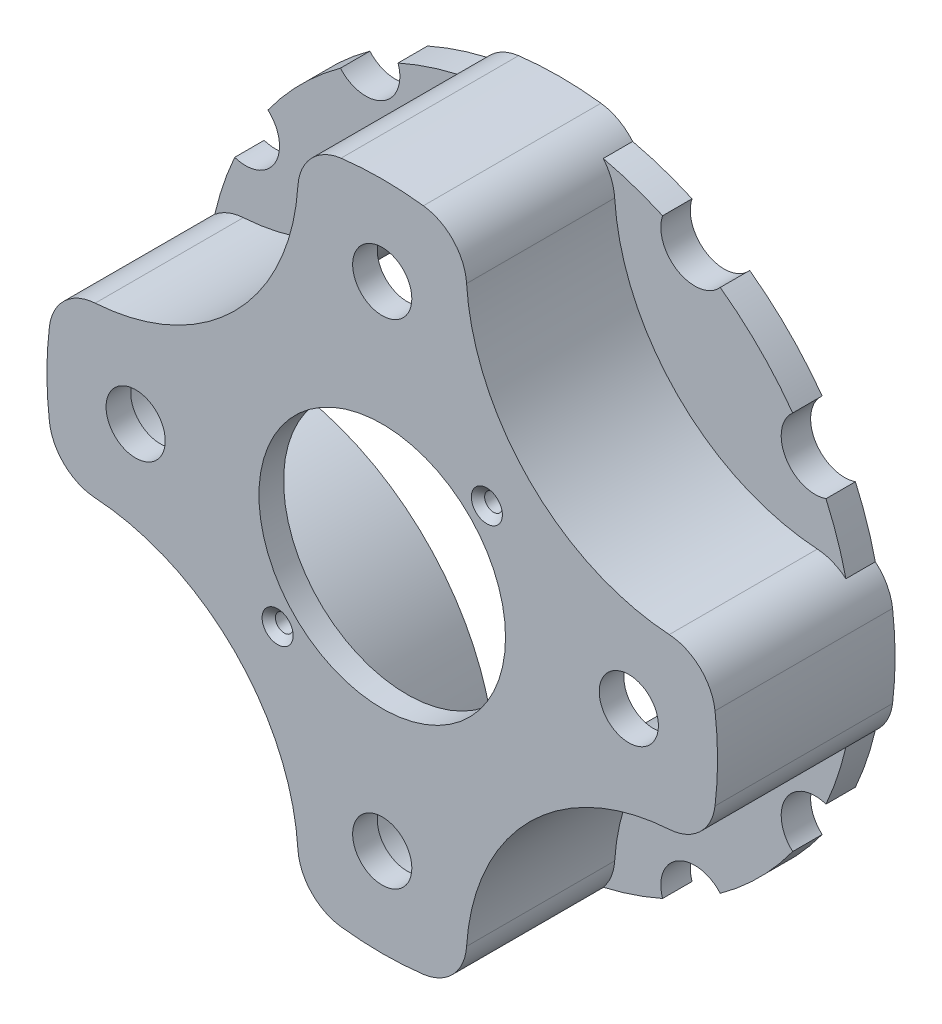
from build123d import *

# Parameters (mm, degrees)
SKETCH6_R                                       = 68
SKETCH6_R_2                                     = 64
SKETCH6_R_3                                     = 62
BOSS_EXTRUDE1_DEPTH                             = 36
SKETCH7_R                                       = 44
CUT_EXTRUDE2_DEPTH                              = 30.031
CIRPATTERN1_COUNT                               = 4
CUT_EXTRUDE3_DEPTH                              = 31
FILLET4_R                                       = 10
CUT_EXTRUDE5_DEPTH                              = 101.746518522
CIRPATTERN3_COUNT                               = 4
SKETCH11_R                                      = 6
SKETCH11_R_2                                    = 25
CUT_EXTRUDE6_DEPTH                              = 103.683981391
SKETCH12_R                                      = 1.5
CUT_EXTRUDE7_DEPTH                              = 103.683981391
CSK_FOR_M3_FLAT_HEAD_MACHINE_SCREW1_D           = 3.6
CSK_FOR_M3_FLAT_HEAD_MACHINE_SCREW1_DEPTH       = 10
CSK_FOR_M3_FLAT_HEAD_MACHINE_SCREW1_CSINK_D     = 6.3
CSK_FOR_M3_FLAT_HEAD_MACHINE_SCREW1_CSINK_ANGLE = 90
CSK_FOR_M3_FLAT_HEAD_MACHINE_SCREW1_TIP         = 1.081549114


with BuildPart() as part:
    # Sketch6 → Boss-Extrude1 (new body)
    # profile 1 of 3: a face of its own
    with BuildSketch(Plane.XY):
        Circle(SKETCH6_R)
        Circle(SKETCH6_R_2, mode=Mode.SUBTRACT)
    # profile 2 of 3: a face of its own
    with BuildSketch(Plane.XY):
        Circle(SKETCH6_R_2)
    # profile 3 of 3: a face of its own
    with BuildSketch(Plane.XY):
        Circle(SKETCH6_R_3)
    extrude(amount=-BOSS_EXTRUDE1_DEPTH)

    # Sketch7 → Cut-Extrude2 (cut)
    with BuildSketch(Plane.XY):
        with Locations((-61.013886211, 61.013886211)):
            Circle(SKETCH7_R)
    cut_extrude2 = extrude(amount=-CUT_EXTRUDE2_DEPTH, mode=Mode.SUBTRACT)

    # CirPattern1: Cut-Extrude2 ×4 about axis
    cirpattern1_axis = Axis((0, 0, 0), (0, 0, 1))
    for i in range(1, CIRPATTERN1_COUNT):
        add(cut_extrude2.rotate(cirpattern1_axis, i * 360 / CIRPATTERN1_COUNT), mode=Mode.SUBTRACT)

    # Sketch9 → Cut-Extrude3 (cut)
    with BuildSketch(Plane(origin=(0, 0, -36), x_dir=(-1, 0, 0), z_dir=(0, 0, -1))):
        with BuildLine():
            ThreePointArc((62.657048552, -13.042019273), (27.072760714, -27.072760714), (13.042019273, -62.657048552))
            ThreePointArc((13.042019273, -62.657048552), (0, -64), (-13.042019273, -62.657048552))
            ThreePointArc((-13.042019273, -62.657048552), (-27.072760714, -27.072760714), (-62.657048552, -13.042019273))
            ThreePointArc((-62.657048552, -13.042019273), (-64, 0), (-62.657048552, 13.042019273))
            ThreePointArc((-62.657048552, 13.042019273), (-27.072760714, 27.072760714), (-13.042019273, 62.657048552))
            ThreePointArc((-13.042019273, 62.657048552), (0, 64), (13.042019273, 62.657048552))
            ThreePointArc((13.042019273, 62.657048552), (27.072760714, 27.072760714), (62.657048552, 13.042019273))
            ThreePointArc((62.657048552, 13.042019273), (64, 0), (62.657048552, -13.042019273))
        make_face()
    extrude(amount=-CUT_EXTRUDE3_DEPTH, mode=Mode.SUBTRACT)

    # Fillet4
    fillet4_edges = [part.edges().sort_by_distance(p)[0] for p in [
        (-17.271690509, -65.769968124, -15.0155),
        (-65.769968124, -17.271690509, -15.0155),
        (65.769968124, -17.271690509, -15.0155),
        (17.271690509, -65.769968124, -15.0155),
        (17.271690509, 65.769968124, -15.0155),
        (65.769968124, 17.271690509, -15.0155),
        (-62.657048552, 13.042019273, -20.5),
        (-13.042019273, 62.657048552, -20.5),
        (13.042019273, 62.657048552, -20.5),
        (62.657048552, 13.042019273, -20.5),
        (62.657048552, -13.042019273, -20.5),
        (13.042019273, -62.657048552, -20.5),
        (-13.042019273, -62.657048552, -20.5),
        (-62.657048552, -13.042019273, -20.5),
        (-65.769968124, 17.271690509, -15.0155),
        (-17.271690509, 65.769968124, -15.0155),
    ]]
    fillet(fillet4_edges, radius=FILLET4_R)

    # Sketch10 → Cut-Extrude5 (cut, through all)
    with BuildSketch(Plane.XY.offset(-30.031)):
        with BuildLine():
            ThreePointArc((-26.820904169, 59.948684093), (-20.900481427, 62.2605453), (-14.784311445, 63.989294105))
            add(Edge.make_bspline(
                [(-8.352752445, 67.485046689), (-8.883437553, 67.419362785), (-9.42082196, 67.31827467), (-9.960949869, 67.179607293), (-10.499190606, 67.001856884), (-11.030427413, 66.78455211), (-12.072716893, 66.270230908), (-12.583596153, 65.972585782), (-13.076868993, 65.636201374), (-13.547283942, 65.262993018), (-13.990103226, 64.856113871), (-14.467362967, 64.349752368), (-14.532423803, 64.279110922), (-14.596663842, 64.207726881), (-14.660067975, 64.135617483), (-14.722621759, 64.062800483), (-14.784311445, 63.989294105)],
                knots=[0, 0, 0, 0, 0, 0, 0, 0.249012775, 0.249012775, 0.249012775, 0.249012775, 0.249012775, 0.5, 0.5, 0.5, 0.5, 0.5, 0.540184109, 0.540184109, 0.540184109, 0.540184109, 0.540184109, 0.540184109, 0.540184109], degree=6))
            ThreePointArc((-8.352752445, 67.485046689), (-18.348613627, 65.477693743), (-27.932001203, 61.99841376))
            ThreePointArc((-27.932001203, 61.99841376), (-27.288993324, 61.020958026), (-26.820904169, 59.948684093))
        make_face()
        with BuildLine():
            ThreePointArc((-26.4575, 57.742243797), (-26.548958945, 58.860327132), (-26.820904169, 59.948684093))
            ThreePointArc((-26.820904169, 59.948684093), (-32.8375, 56.876218394), (-38.506631264, 53.20192641))
            ThreePointArc((-38.506631264, 53.20192641), (-30.911518044, 51.304153122), (-26.4575, 57.742243797))
        make_face()
        with BuildLine():
            ThreePointArc((-38.506631264, 53.20192641), (-32.8375, 56.876218394), (-26.820904169, 59.948684093))
            ThreePointArc((-26.820904169, 59.948684093), (-27.288993324, 61.020958026), (-27.932001203, 61.99841376))
            ThreePointArc((-27.932001203, 61.99841376), (-34, 58.889727457), (-39.726200709, 55.1890295))
            ThreePointArc((-39.726200709, 55.1890295), (-39.201203152, 54.143440476), (-38.506631264, 53.20192641))
        make_face()
        with BuildLine():
            ThreePointArc((-53.20192641, 38.506631264), (-46.439237854, 46.439237854), (-38.506631264, 53.20192641))
            ThreePointArc((-38.506631264, 53.20192641), (-39.201203152, 54.143440476), (-39.726200709, 55.1890295))
            ThreePointArc((-39.726200709, 55.1890295), (-48.083261121, 48.083261121), (-55.1890295, 39.726200709))
            ThreePointArc((-55.1890295, 39.726200709), (-54.143440476, 39.201203152), (-53.20192641, 38.506631264))
        make_face()
        with BuildLine():
            add(Edge.make_bspline(
                [(-67.485046689, 8.352752445), (-67.419362785, 8.883437553), (-67.31827467, 9.42082196), (-67.179607293, 9.960949869), (-67.001856884, 10.499190606), (-66.78455211, 11.030427413), (-66.270230908, 12.072716893), (-65.972585782, 12.583596153), (-65.636201374, 13.076868993), (-65.262993018, 13.547283942), (-64.856113871, 13.990103226), (-64.349752368, 14.467362967), (-64.279110922, 14.532423803), (-64.207726881, 14.596663842), (-64.135617483, 14.660067975), (-64.062800483, 14.722621759), (-63.989294105, 14.784311445)],
                knots=[0, 0, 0, 0, 0, 0, 0, 0.249012775, 0.249012775, 0.249012775, 0.249012775, 0.249012775, 0.5, 0.5, 0.5, 0.5, 0.5, 0.540184109, 0.540184109, 0.540184109, 0.540184109, 0.540184109, 0.540184109, 0.540184109], degree=6))
            ThreePointArc((-63.989294105, 14.784311445), (-62.2605453, 20.900481427), (-59.948684093, 26.820904169))
            ThreePointArc((-59.948684093, 26.820904169), (-61.020958026, 27.288993324), (-61.99841376, 27.932001203))
            ThreePointArc((-61.99841376, 27.932001203), (-65.477693743, 18.348613627), (-67.485046689, 8.352752445))
        make_face()
        with BuildLine():
            ThreePointArc((-50.862243797, 33.3375), (-51.47439793, 36.174489282), (-53.20192641, 38.506631264))
            ThreePointArc((-53.20192641, 38.506631264), (-56.876218394, 32.8375), (-59.948684093, 26.820904169))
            ThreePointArc((-59.948684093, 26.820904169), (-53.732624691, 27.746672278), (-50.862243797, 33.3375))
        make_face()
        with BuildLine():
            ThreePointArc((-59.948684093, 26.820904169), (-56.876218394, 32.8375), (-53.20192641, 38.506631264))
            ThreePointArc((-53.20192641, 38.506631264), (-54.143440476, 39.201203152), (-55.1890295, 39.726200709))
            ThreePointArc((-55.1890295, 39.726200709), (-58.889727457, 34), (-61.99841376, 27.932001203))
            ThreePointArc((-61.99841376, 27.932001203), (-61.020958026, 27.288993324), (-59.948684093, 26.820904169))
        make_face()
    cut_extrude5 = extrude(amount=-CUT_EXTRUDE5_DEPTH, mode=Mode.SUBTRACT)

    # CirPattern3: Cut-Extrude5 ×4 about axis
    cirpattern3_axis = Axis((0, 0, 0), (0, 0, 1))
    for i in range(1, CIRPATTERN3_COUNT):
        add(cut_extrude5.rotate(cirpattern3_axis, i * 360 / CIRPATTERN3_COUNT), mode=Mode.SUBTRACT)

    # Sketch11 → Cut-Extrude6 (cut, through all)
    with BuildSketch(Plane.XY):
        with Locations((0, -50)):
            Circle(SKETCH11_R)
        with Locations((50, 0)):
            Circle(SKETCH11_R)
        with Locations((0, 50)):
            Circle(SKETCH11_R)
        Circle(SKETCH11_R_2)
        with Locations((-50, 0)):
            Circle(SKETCH11_R)
    extrude(amount=-CUT_EXTRUDE6_DEPTH, mode=Mode.SUBTRACT)

    # Sketch12 → Cut-Extrude7 (cut, through all)
    with BuildSketch(Plane.XY):
        with Locations((21.213203436, 21.213203436)):
            Circle(SKETCH12_R)
        with Locations((-21.213203436, -21.213203436)):
            Circle(SKETCH12_R)
    extrude(amount=-CUT_EXTRUDE7_DEPTH, mode=Mode.SUBTRACT)

    # CSK for M3 Flat Head Machine Screw1
    with Locations(Plane.XY):
        with Locations((21.213203436, 21.213203436), (-21.213203436, -21.213203436)):
            CounterSinkHole(CSK_FOR_M3_FLAT_HEAD_MACHINE_SCREW1_D / 2, CSK_FOR_M3_FLAT_HEAD_MACHINE_SCREW1_CSINK_D / 2, depth=CSK_FOR_M3_FLAT_HEAD_MACHINE_SCREW1_DEPTH, counter_sink_angle=CSK_FOR_M3_FLAT_HEAD_MACHINE_SCREW1_CSINK_ANGLE)
            with Locations((0, 0, -(CSK_FOR_M3_FLAT_HEAD_MACHINE_SCREW1_DEPTH + CSK_FOR_M3_FLAT_HEAD_MACHINE_SCREW1_TIP / 2))):  # 118° drill point
                Cone(0, CSK_FOR_M3_FLAT_HEAD_MACHINE_SCREW1_D / 2, CSK_FOR_M3_FLAT_HEAD_MACHINE_SCREW1_TIP, mode=Mode.SUBTRACT)


solid = part.part
